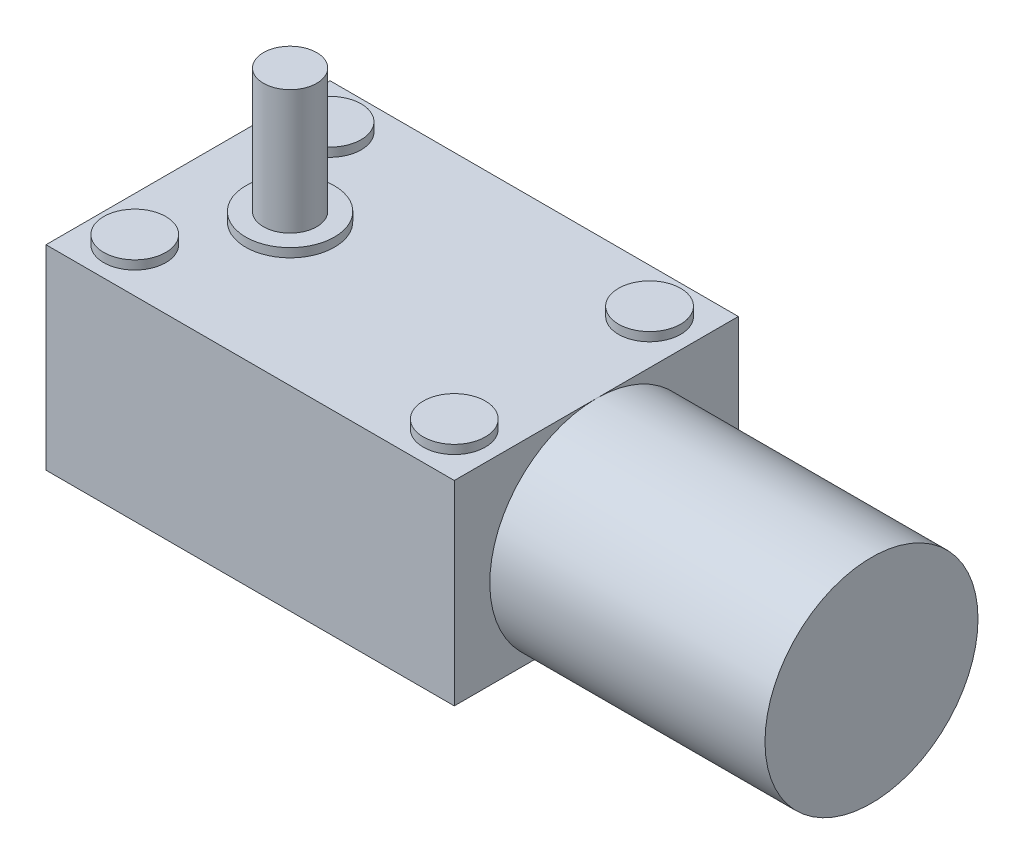
from build123d import *

# Parameters (mm, degrees)
SKETCH_1_W      = 46
SKETCH_1_H      = 32
EXTRUDE_1_DEPTH = 22
SKETCH_2_R      = 12
EXTRUDE_2_DEPTH = 31
SKETCH_3_R      = 5
EXTRUDE_3_DEPTH = 1
SKETCH_4_R      = 3
EXTRUDE_4_DEPTH = 14
SKETCH_5_R      = 3.5
EXTRUDE_5_DEPTH = 1


with BuildPart() as part:
    # Эскиз1 → Бобышка-Вытянуть1 (new body)
    with BuildSketch(Plane(origin=(0, 0, 0), x_dir=(1, 0, 0), z_dir=(0, 1, 0))):
        Rectangle(SKETCH_1_W, SKETCH_1_H)
    extrude(amount=EXTRUDE_1_DEPTH)

    # Эскиз2 → Бобышка-Вытянуть2 (add)
    with BuildSketch(Plane(origin=(23, 0, 0), x_dir=(0, 0, -1), z_dir=(1, 0, 0))):
        with Locations(Location((0, 10, 0), (0, 0, 236.442690238))):
            Circle(SKETCH_2_R)
    extrude(amount=EXTRUDE_2_DEPTH)

    # Эскиз3 → Бобышка-Вытянуть3 (add)
    with BuildSketch(Plane(origin=(0, 22, 0), x_dir=(1, 0, 0), z_dir=(0, 1, 0))):
        with Locations(Location((-11.5, 0, 0), (0, 0, 90))):
            Circle(SKETCH_3_R)
    extrude(amount=EXTRUDE_3_DEPTH)

    # Эскиз4 → Бобышка-Вытянуть4 (add)
    with BuildSketch(Plane(origin=(0, 23, 0), x_dir=(1, 0, 0), z_dir=(0, 1, 0))):
        with Locations(Location((-11.5, 0, 0), (0, 0, 270))):
            Circle(SKETCH_4_R)
    extrude(amount=EXTRUDE_4_DEPTH)

    # Эскиз5 → Бобышка-Вытянуть5 (add)
    with BuildSketch(Plane(origin=(0, 22, 0), x_dir=(1, 0, 0), z_dir=(0, 1, 0))):
        with Locations(Location((18, 11, 0), (0, 0, 90))):
            Circle(SKETCH_5_R)
        with Locations(Location((18, -11, 0), (0, 0, 90))):
            Circle(SKETCH_5_R)
        with Locations(Location((-18, -11, 0), (0, 0, 90))):
            Circle(SKETCH_5_R)
        with Locations(Location((-18, 11, 0), (0, 0, 90))):
            Circle(SKETCH_5_R)
    extrude(amount=EXTRUDE_5_DEPTH)


solid = part.part
